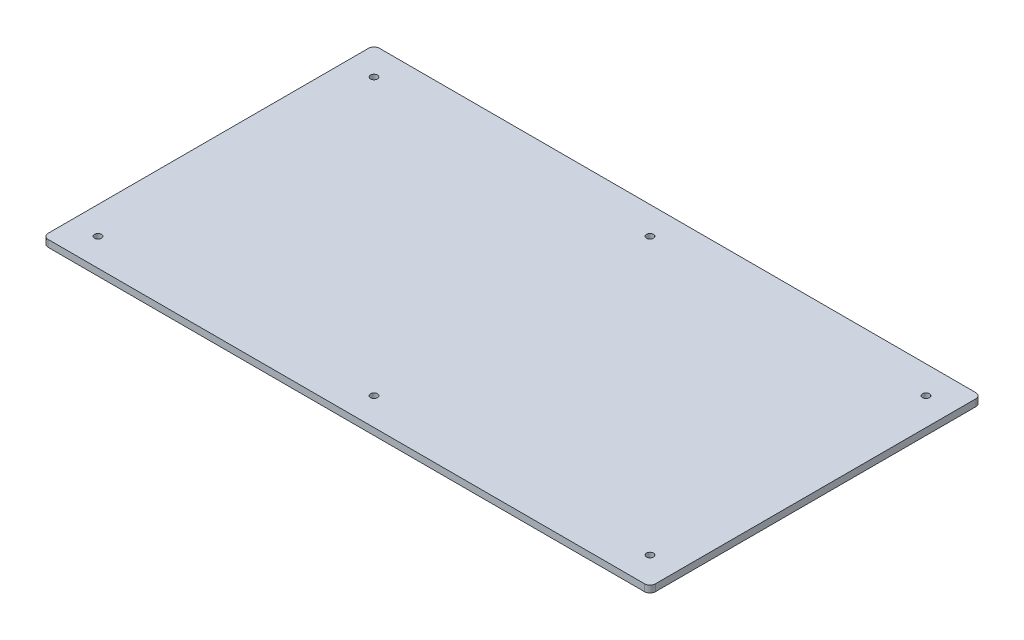
from build123d import *

# Parameters (mm, degrees)
SKETCH1_W           = 1117.6
SKETCH1_H           = 609.6
BOSS_EXTRUDE1_DEPTH = 12.7
SKETCH2_R           = 6.35
CUT_EXTRUDE1_DEPTH  = 1116.996604756
SKETCH3_R           = 6.35
CUT_EXTRUDE2_DEPTH  = 1116.996604756
FILLET1_R           = 10


with BuildPart() as part:
    # Sketch1 → Boss-Extrude1 (new body)
    with BuildSketch(Plane(origin=(0, 0, 0), x_dir=(1, 0, 0), z_dir=(0, 1, 0))):
        with Locations((490.196746459, 75.848075978)):
            Rectangle(SKETCH1_W, SKETCH1_H)
    extrude(amount=BOSS_EXTRUDE1_DEPTH)

    # Sketch2 → Cut-Extrude1 (cut, through all)
    with BuildSketch(Plane(origin=(0, 12.7, 0), x_dir=(1, 0, 0), z_dir=(0, 1, 0))):
        with Locations(Location((998.196746459, -178.151924022, 0), (0, 0, 270))):
            Circle(SKETCH2_R)
        with Locations(Location((-17.803253541, -178.151924022, 0), (0, 0, 270))):
            Circle(SKETCH2_R)
        with Locations(Location((-17.803253541, 329.848075978, 0), (0, 0, 270))):
            Circle(SKETCH2_R)
        with Locations(Location((998.196746459, 329.848075978, 0), (0, 0, 270))):
            Circle(SKETCH2_R)
    extrude(amount=-CUT_EXTRUDE1_DEPTH, mode=Mode.SUBTRACT)

    # Sketch3 → Cut-Extrude2 (cut, through all)
    with BuildSketch(Plane(origin=(0, 12.7, 0), x_dir=(1, 0, 0), z_dir=(0, 1, 0))):
        with Locations(Location((490.196746459, -178.151924022, 0), (0, 0, 270))):
            Circle(SKETCH3_R)
        with Locations(Location((490.196746459, 329.848075978, 0), (0, 0, 270))):
            Circle(SKETCH3_R)
    extrude(amount=-CUT_EXTRUDE2_DEPTH, mode=Mode.SUBTRACT)

    # Fillet1
    fillet1_edges = [part.edges().sort_by_distance(p)[0] for p in [
        (1048.996746459, 6.35, 228.951924022),
        (-68.603253541, 6.35, 228.951924022),
        (-68.603253541, 6.35, -380.648075978),
        (1048.996746459, 6.35, -380.648075978),
    ]]
    fillet(fillet1_edges, radius=FILLET1_R)


solid = part.part
